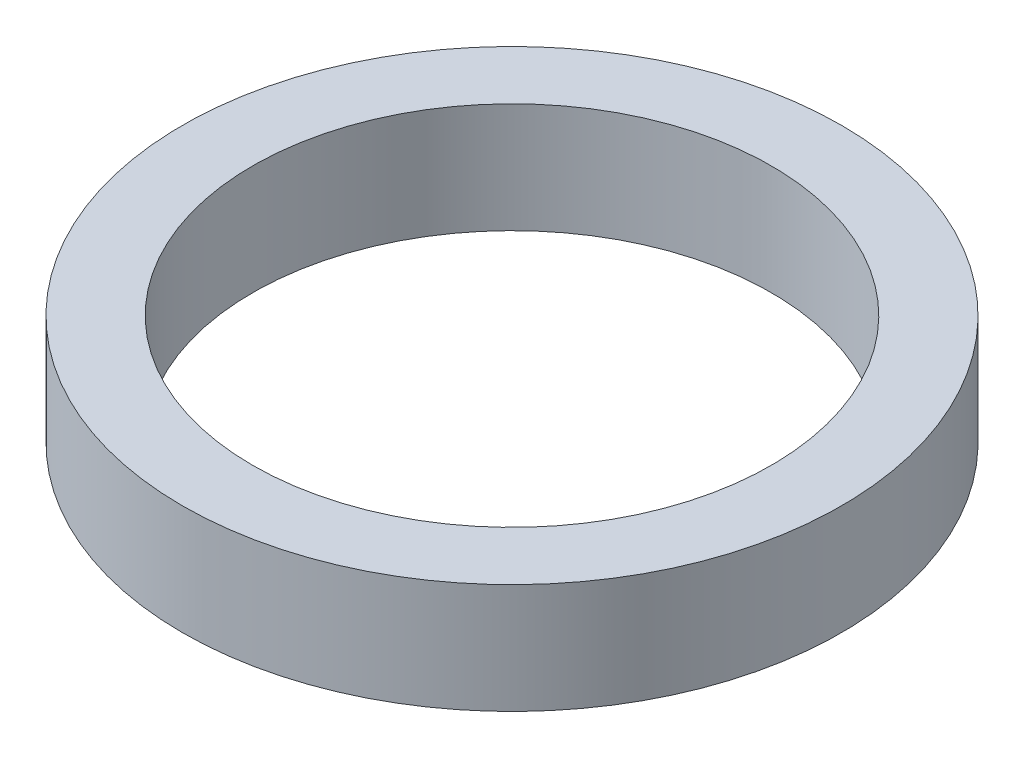
from build123d import *

# Parameters (mm, degrees)
SKETCH1_R           = 5.4
SKETCH1_R_2         = 4.25
BOSS_EXTRUDE1_DEPTH = 1.8


with BuildPart() as part:
    # Sketch1 → Boss-Extrude1 (new body)
    with BuildSketch(Plane(origin=(0, 0, 0), x_dir=(1, 0, 0), z_dir=(0, 1, 0))):
        with Locations(Location((0, 0, 0), (0, 0, 270))):
            Circle(SKETCH1_R)
        with Locations(Location((0, 0, 0), (0, 0, 270))):
            Circle(SKETCH1_R_2, mode=Mode.SUBTRACT)
    extrude(amount=BOSS_EXTRUDE1_DEPTH)


solid = part.part
